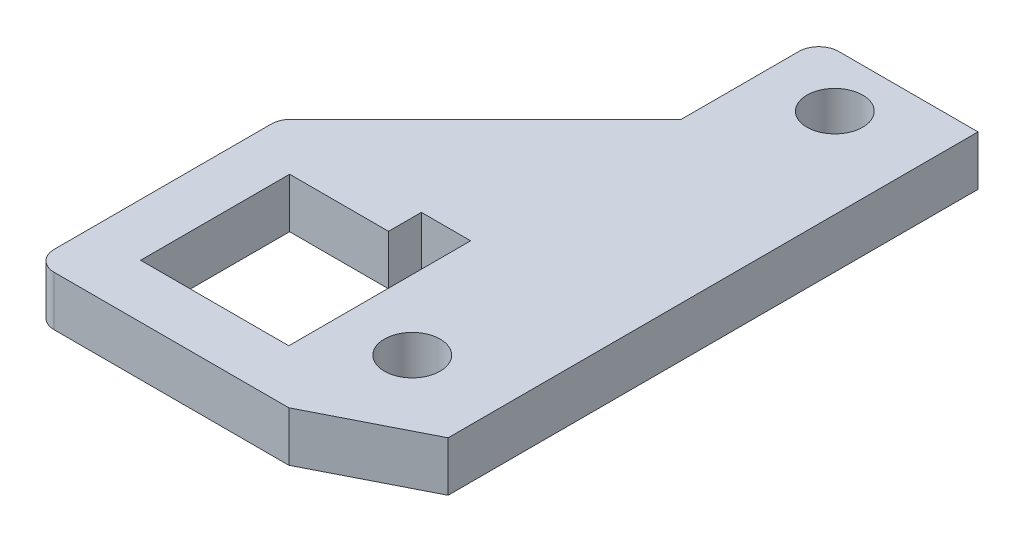
from build123d import *

# Parameters (mm, degrees)
SKETCH1_R           = 1.778
BOSS_EXTRUDE1_DEPTH = 3.175


with BuildPart() as part:
    # Sketch1 → Boss-Extrude1 (new body)
    with BuildSketch(Plane.XZ):
        with BuildLine():
            Line((0, -1.27), (0, -15.096211993))
            ThreePointArc((0, -15.096211993), (0.096672994, -15.582219953), (0.371974388, -15.994237606))
            Line((0.371974388, -15.994237606), (12.811233382, -28.4334966))
            Line((12.811233382, -28.4334966), (12.811233382, -35.9325926))
            ThreePointArc((12.811233382, -35.9325926), (13.18320777, -36.830618212), (14.081233382, -37.2025926))
            Line((14.081233382, -37.2025926), (22.963359382, -37.2025926))
            Line((22.963359382, -37.2025926), (22.963359382, -3.420573773))
            Line((22.963359382, -3.420573773), (16.223955667, 0))
            Line((16.223955667, 0), (1.27, 0))
            ThreePointArc((1.27, 0), (0.371974388, -0.371974388), (0, -1.27))
        make_face()
        with Locations(Location((17.255979382, -33.7812126, 0), (0, 0, 90))):
            Circle(SKETCH1_R, mode=Mode.SUBTRACT)
        with Locations(Location((17.255979382, -6.840444237, 0), (0, 0, 90))):
            Circle(SKETCH1_R, mode=Mode.SUBTRACT)
        Polygon((9.66216, -12.92098), (3.35788, -12.92098), (3.35788, -3.42138), (12.80414, -3.42138), (12.80414, -15.01648), (9.66216, -15.01648), align=None, mode=Mode.SUBTRACT)
    extrude(amount=-BOSS_EXTRUDE1_DEPTH)


solid = part.part
